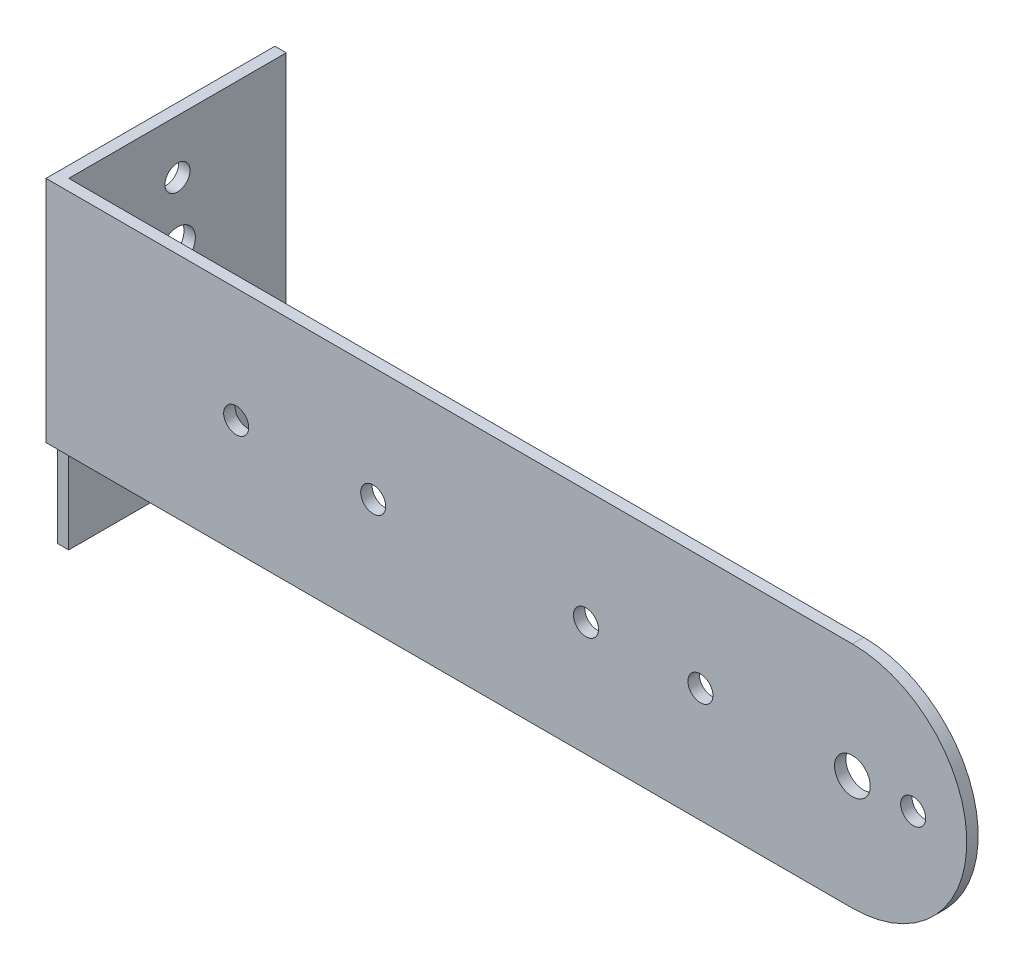
from build123d import *

# Parameters (mm, degrees)
BOSS_EXTRUDE1_DEPTH = 1.59
SKETCH2_W           = 1.59
SKETCH2_H           = 45
BOSS_EXTRUDE2_DEPTH = 30.41
SKETCH3_R           = 1.75
SKETCH3_R_2         = 2.5
CUT_EXTRUDE1_DEPTH  = 121.32593486
SKETCH4_R           = 2.5
SKETCH4_R_2         = 1.75
CUT_EXTRUDE2_DEPTH  = 30.41


with BuildPart() as part:
    # Sketch1 → Boss-Extrude1 (new body)
    with BuildSketch(Plane.XY):
        with BuildLine():
            Line((0, 16), (-112.75, 16))
            Line((-112.75, 16), (-112.75, -16))
            Line((-112.75, -16), (0, -16))
            ThreePointArc((0, -16), (16, 0), (0, 16))
        make_face()
    extrude(amount=BOSS_EXTRUDE1_DEPTH)

    # Sketch2 → Boss-Extrude2 (add)
    with BuildSketch(Plane(origin=(0, 0, 0), x_dir=(-1, 0, 0), z_dir=(0, 0, -1))):
        with Locations((111.955, -6.5)):
            Rectangle(SKETCH2_W, SKETCH2_H)
    extrude(amount=BOSS_EXTRUDE2_DEPTH)

    # Sketch3 → Cut-Extrude1 (cut, through all)
    with BuildSketch(Plane(origin=(0, 0, 0), x_dir=(-1, 0, 0), z_dir=(0, 0, -1))):
        with Locations((86.16, 0)):
            Circle(SKETCH3_R)
        with Locations((37.25, 0)):
            Circle(SKETCH3_R)
        with Locations((67, 0)):
            Circle(SKETCH3_R)
        with Locations((-8.5, 0)):
            Circle(SKETCH3_R)
        Circle(SKETCH3_R_2)
        with Locations((21.25, 0)):
            Circle(SKETCH3_R)
    extrude(amount=-CUT_EXTRUDE1_DEPTH, mode=Mode.SUBTRACT)

    # Sketch4 → Cut-Extrude2 (cut)
    with BuildSketch(Plane.ZY.offset(112.75)):
        with Locations((-15.205, 0)):
            Circle(SKETCH4_R)
        with Locations((-15.205, 8.5)):
            Circle(SKETCH4_R_2)
        with Locations((-15.205, -21.25)):
            Circle(SKETCH4_R_2)
    extrude(amount=-CUT_EXTRUDE2_DEPTH, mode=Mode.SUBTRACT)


solid = part.part
